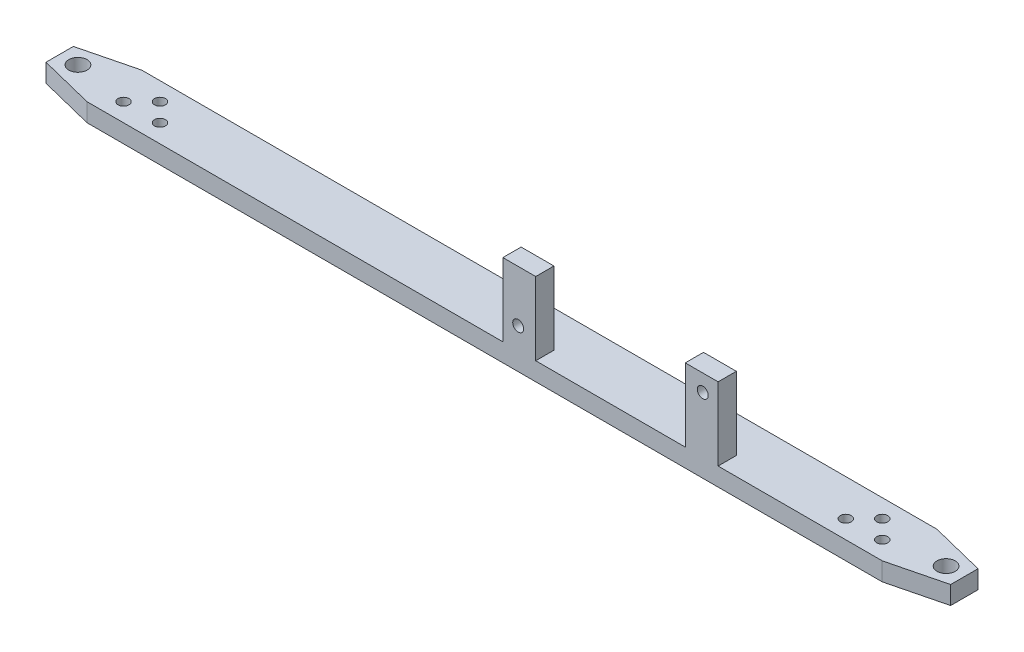
from build123d import *

# Parameters (mm, degrees)
BOSS_EXTRUDE1_DEPTH = 5
SKETCH2_R           = 1.5
SKETCH2_R_2         = 2.5
CUT_EXTRUDE1_DEPTH  = 5
SKETCH4_W           = 9
SKETCH4_H           = 5
BOSS_EXTRUDE2_DEPTH = 20
SKETCH6_R           = 1.5
CUT_EXTRUDE2_DEPTH  = 5


with BuildPart() as part:
    # Sketch1 → Boss-Extrude1 (new body)
    with BuildSketch(Plane(origin=(0, 0, 0), x_dir=(1, 0, 0), z_dir=(0, 1, 0))):
        Polygon((-67.598283163, 7.319100723), (-52.598283163, 3.569100723), (165.401716837, 3.569100723), (180.401716837, 7.319100723), (180.401716837, 14.819100723), (165.401716837, 18.569100723), (-52.598283163, 18.569100723), (-67.598283163, 14.819100723), align=None)
    extrude(amount=BOSS_EXTRUDE1_DEPTH)

    # Sketch2 → Cut-Extrude1 (cut)
    with BuildSketch(Plane(origin=(0, 5, 0), x_dir=(1, 0, 0), z_dir=(0, 1, 0))):
        with Locations(Location((155.401716837, 13.569100723, 0), (0, 0, 270))):
            Circle(SKETCH2_R)
        with Locations(Location((160.401716837, 8.569100723, 0), (0, 0, 270))):
            Circle(SKETCH2_R)
        with Locations(Location((150.401716837, 8.569100723, 0), (0, 0, 270))):
            Circle(SKETCH2_R)
        with Locations(Location((-47.598283163, 8.569100723, 0), (0, 0, 270))):
            Circle(SKETCH2_R)
        with Locations(Location((-37.598283163, 8.569100723, 0), (0, 0, 270))):
            Circle(SKETCH2_R)
        with Locations(Location((-42.598283163, 13.569100723, 0), (0, 0, 270))):
            Circle(SKETCH2_R)
        with Locations(Location((-62.598283163, 11.069100723, 0), (0, 0, 270))):
            Circle(SKETCH2_R_2)
        with Locations(Location((175.401716837, 11.069100723, 0), (0, 0, 270))):
            Circle(SKETCH2_R_2)
    extrude(amount=-CUT_EXTRUDE1_DEPTH, mode=Mode.SUBTRACT)

    # Sketch4 → Boss-Extrude2 (add)
    with BuildSketch(Plane(origin=(-36.696088283, 5, 1.62747237), x_dir=(1, 0, 0), z_dir=(0, 1, 0))):
        with Locations((102.59780512, 7.696573093)):
            Rectangle(SKETCH4_W, SKETCH4_H)
        with Locations((152.59780512, 7.696573093)):
            Rectangle(SKETCH4_W, SKETCH4_H)
    extrude(amount=BOSS_EXTRUDE2_DEPTH)

    # Sketch6 → Cut-Extrude2 (cut)
    with BuildSketch(Plane(origin=(-36.696088283, 0, -3.569100723), x_dir=(1, 0, 0), z_dir=(0, 0, 1))):
        with Locations((102.29780512, 10.9)):
            Circle(SKETCH6_R)
        with Locations((152.89780512, 20.4)):
            Circle(SKETCH6_R)
    extrude(amount=-CUT_EXTRUDE2_DEPTH, mode=Mode.SUBTRACT)


solid = part.part
